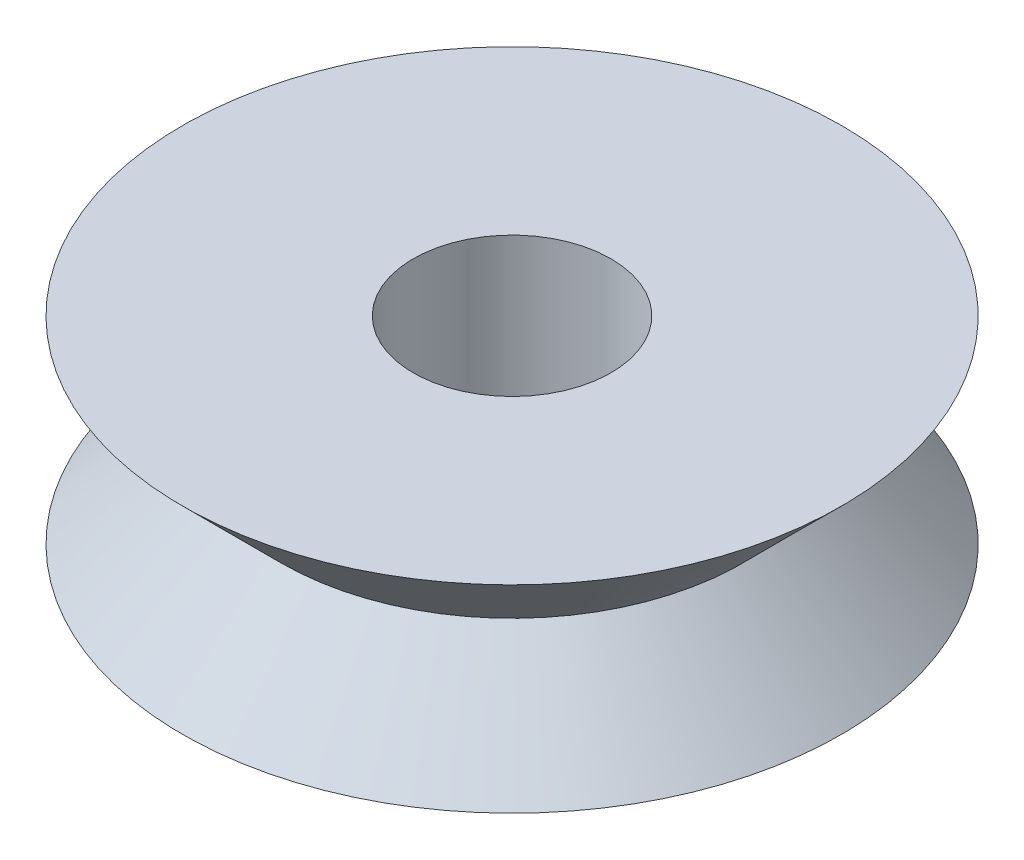
from build123d import *


with BuildPart() as part:
    # Sketch1 → Revolve1 (revolve)
    with BuildSketch(Plane.XY, mode=Mode.PRIVATE) as revolve1_sk:
        Polygon((1.5, 0), (5, 0), (3.5, 1.5), (5, 3), (1.5, 3), align=None)
    revolve(revolve1_sk.sketch.rotate(Axis((0, 0, 0), (0, 1, 0)), 90), axis=Axis((0, 0, 0), (0, 1, 0)))


solid = part.part
